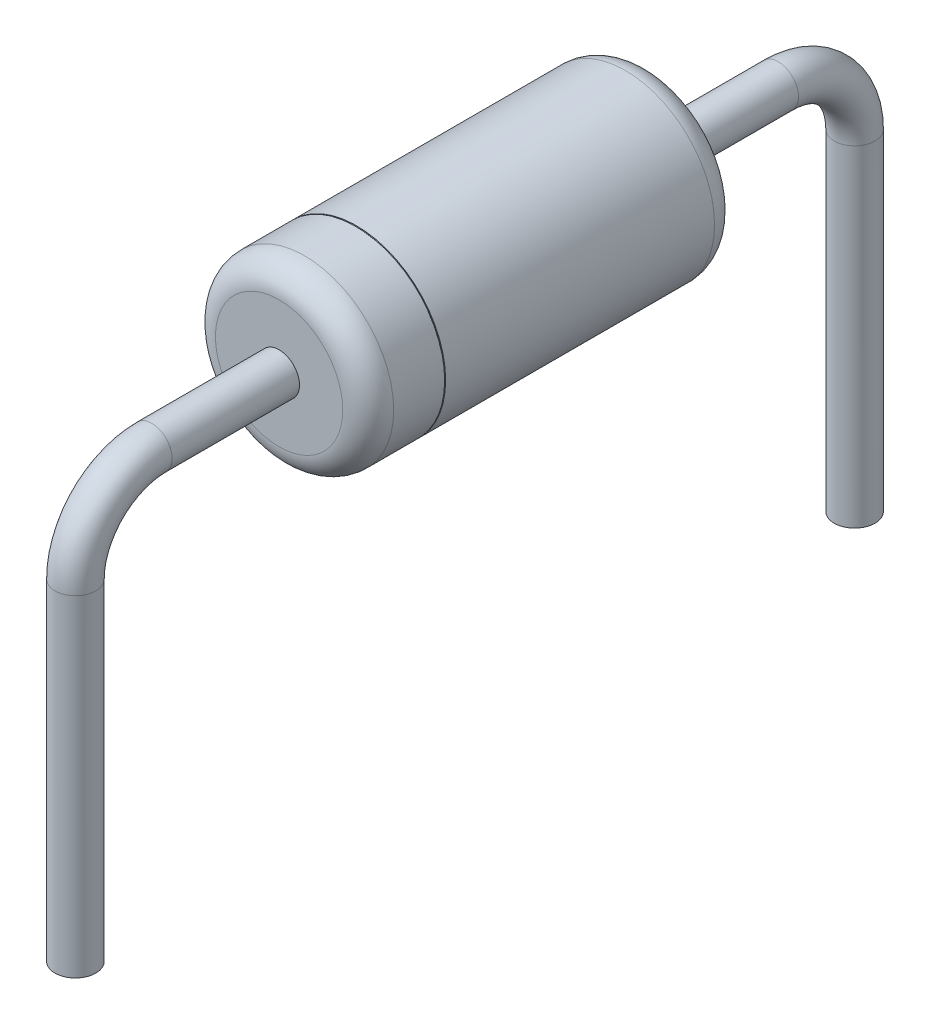
from build123d import *

# Parameters (mm, degrees)
SWEEP1_PROFILE_R = 0.2


with BuildPart() as part:
    # Sketch1 → Revolve1 (revolve)
    with BuildSketch(Plane(origin=(0, 0, 0), x_dir=(0, 0, -1), z_dir=(1, 0, 0)), mode=Mode.PRIVATE) as revolve1_sk:
        with BuildLine():
            Line((-1.83, 0.875), (-1.33, 0.875))
            Line((-1.33, 0.875), (-1.33, 0.865))
            Line((-1.33, 0.865), (-1.32, 0.865))
            Line((-1.32, 0.865), (-1.32, 0.875))
            Line((-1.32, 0.875), (1.32, 0.875))
            ThreePointArc((1.32, 0.875), (1.496776695, 0.801776695), (1.57, 0.625))
            Line((1.57, 0.625), (1.57, 0))
            Line((1.57, 0), (-2.08, 0))
            Line((-2.08, 0), (-2.08, 0.625))
            ThreePointArc((-2.08, 0.625), (-2.006776695, 0.801776695), (-1.83, 0.875))
        make_face()
    revolve(revolve1_sk.sketch.rotate(Axis((0, 0, 2.08), (0, 0, -1)), 90), axis=Axis((0, 0, 2.08), (0, 0, -1)))


with BuildPart() as body_2:
    # Sweep1: sweep along a path in Sketch2
    with BuildLine(Plane(origin=(0, 0, 0), x_dir=(0, 0, -1), z_dir=(1, 0, 0))) as sweep1_path:
        Line((-4.08, -4), (-4.08, -0.75))
        ThreePointArc((-4.08, -0.75), (-3.860330086, -0.219669914), (-3.33, 0))
        Line((-3.33, 0), (0, 0))
        Line((0, 0), (2.82, 0))
        ThreePointArc((2.82, 0), (3.350330086, -0.219669914), (3.57, -0.75))
        Line((3.57, -0.75), (3.57, -4))
    # Sweep1 profile (on start of the path) → Sweep1 (sweep)
    with BuildSketch(Plane(origin=(0, -4, 4.08), x_dir=(0, 0, 1), z_dir=(0, 1, 0))):
        Circle(SWEEP1_PROFILE_R)
    sweep(path=sweep1_path.line)


solid = Compound([part.part, body_2.part])
